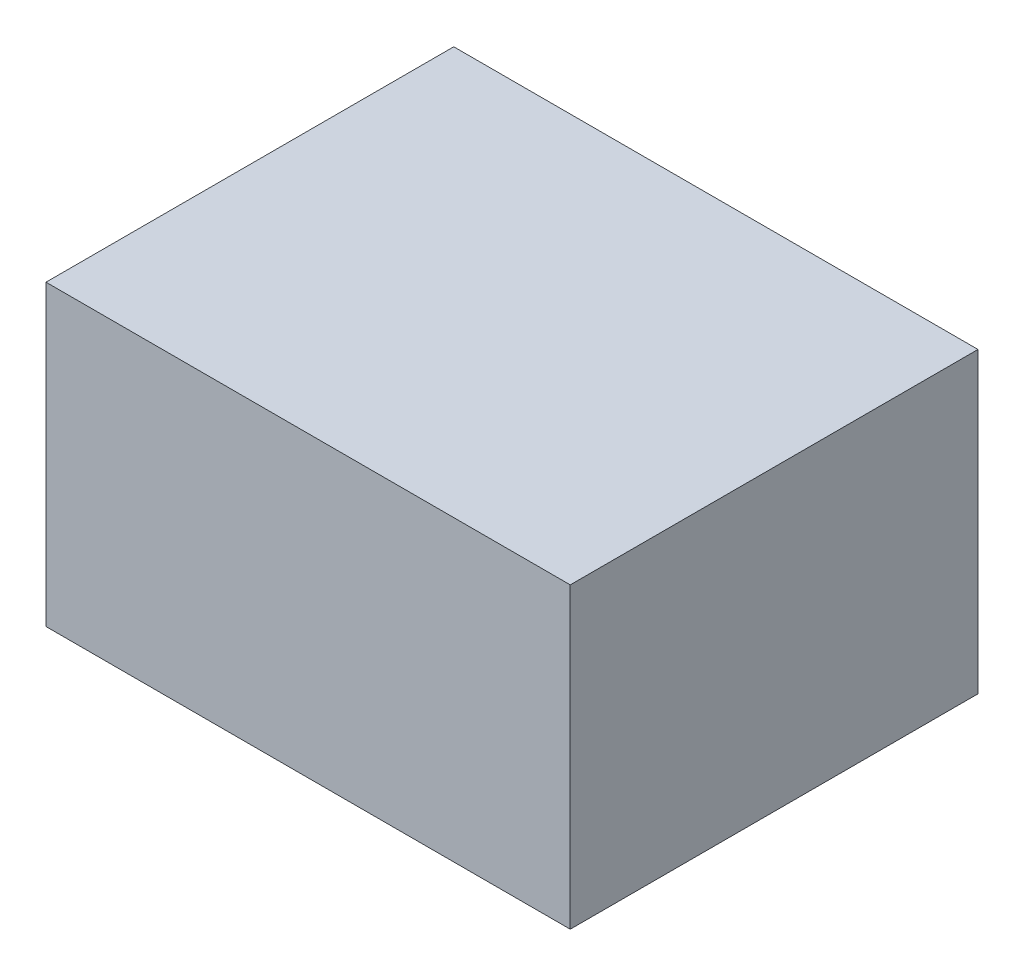
from build123d import *

# Parameters (mm, degrees)
SKETCH_1_W           = 4.5
SKETCH_1_H           = 2.56
BODY_DEPTH           = 3.5
SKETCH_2_W           = 2
SKETCH_2_H           = 0.83
STEM_FULL_DEPTH      = 2.55
SKETCH_3_W           = 2.4
SKETCH_3_H           = 1.1
STEM_LOWER_GAP_DEPTH = 0.95


with BuildPart() as part:
    # 草圖1 → body (new body)
    with BuildSketch(Plane.XY):
        with Locations((0, 0.07)):
            Rectangle(SKETCH_1_W, SKETCH_1_H)
    extrude(amount=BODY_DEPTH)

    # 草圖2 → stem full (add)
    with BuildSketch(Plane.XY):
        with Locations((0, -1.625)):
            Rectangle(SKETCH_2_W, SKETCH_2_H)
    extrude(amount=STEM_FULL_DEPTH)

    # 草圖3 → stem lower gap (cut)
    with BuildSketch(Plane.XY):
        with Locations((0, -1.65)):
            Rectangle(SKETCH_3_W, SKETCH_3_H)
    extrude(amount=STEM_LOWER_GAP_DEPTH, mode=Mode.SUBTRACT)


solid = part.part
